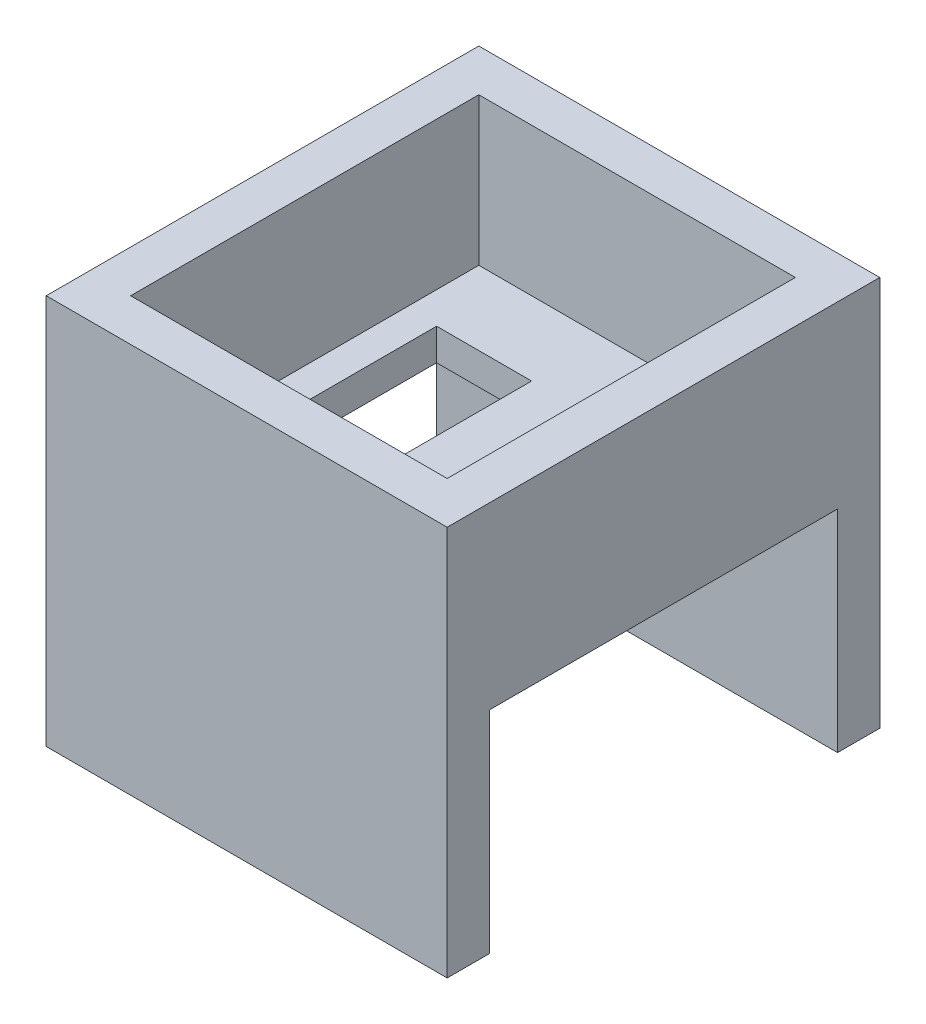
from build123d import *

# Parameters (mm, degrees)
SKETCH1_W           = 38
SKETCH1_H           = 41
BOSS_EXTRUDE1_DEPTH = 37
SKETCH2_W           = 30
SKETCH2_H           = 33
CUT_EXTRUDE1_DEPTH  = 14
SKETCH3_W           = 33
SKETCH3_H           = 20
CUT_EXTRUDE2_DEPTH  = 57.861674263
SKETCH4_W           = 9
SKETCH4_H           = 19
CUT_EXTRUDE3_DEPTH  = 37.197375595


with BuildPart() as part:
    # Sketch1 → Boss-Extrude1 (new body)
    with BuildSketch(Plane(origin=(0, 0, 0), x_dir=(1, 0, 0), z_dir=(0, 1, 0))):
        Rectangle(SKETCH1_W, SKETCH1_H)
    extrude(amount=BOSS_EXTRUDE1_DEPTH)

    # Sketch2 → Cut-Extrude1 (cut)
    with BuildSketch(Plane(origin=(0, 37, 0), x_dir=(1, 0, 0), z_dir=(0, 1, 0))):
        Rectangle(SKETCH2_W, SKETCH2_H)
    extrude(amount=-CUT_EXTRUDE1_DEPTH, mode=Mode.SUBTRACT)

    # Sketch3 → Cut-Extrude2 (cut, through all)
    with BuildSketch(Plane.ZY.offset(19)):
        with Locations((0, 10)):
            Rectangle(SKETCH3_W, SKETCH3_H)
    extrude(amount=-CUT_EXTRUDE2_DEPTH, mode=Mode.SUBTRACT)

    # Sketch4 → Cut-Extrude3 (cut, through all)
    with BuildSketch(Plane(origin=(0, 23, 0), x_dir=(1, 0, 0), z_dir=(0, 1, 0))):
        with Locations((-7.5, 0)):
            Rectangle(SKETCH4_W, SKETCH4_H)
    extrude(amount=-CUT_EXTRUDE3_DEPTH, mode=Mode.SUBTRACT)


solid = part.part
